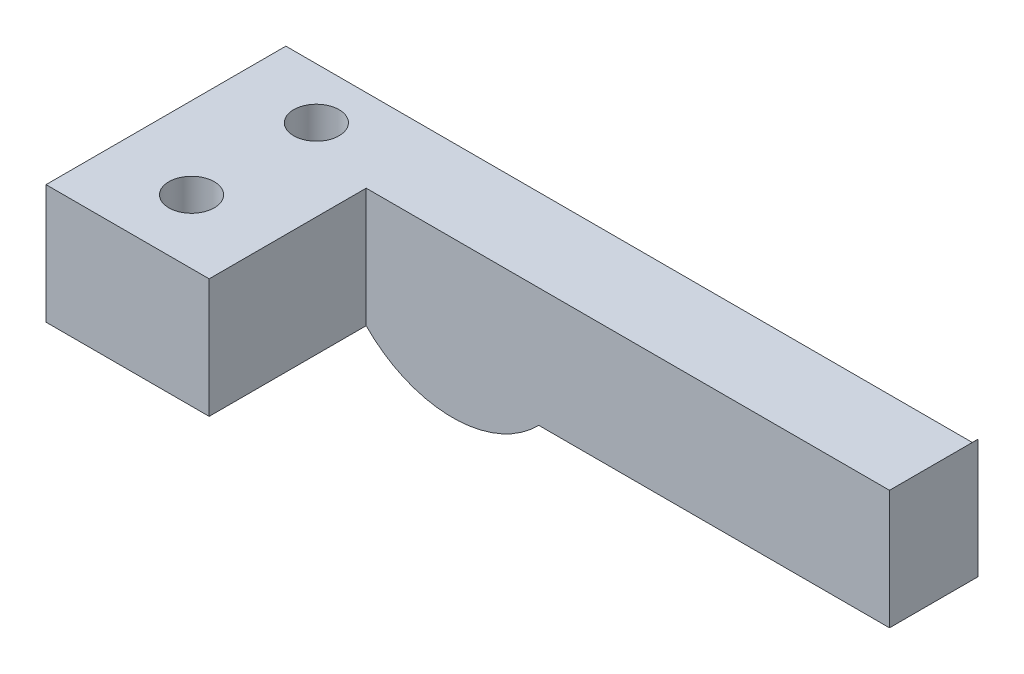
from build123d import *

# Parameters (mm, degrees)
BOSS_EXTRUDE3_DEPTH = 10.82
BOSS_EXTRUDE4_DEPTH = 3.9
SKETCH3_R           = 1
CUT_EXTRUDE1_DEPTH  = 5.25
CUT_EXTRUDE2_DEPTH  = 10


with BuildPart() as part:
    # Sketch2 → Boss-Extrude3 (new body)
    with BuildSketch(Plane.XY):
        Polygon((8.44, 0), (3, 0), (1.25, 0), (1.25, -5.25), (3, -5.25), (8.44, -5.25), align=None)
    extrude(amount=BOSS_EXTRUDE3_DEPTH)

    # Sketch2<5> → Boss-Extrude4 (add)
    with BuildSketch(Plane.XY):
        with BuildLine():
            Line((31.5, 0), (8.44, 0))
            Line((8.44, 0), (8.44, -5.25))
            ThreePointArc((8.44, -5.25), (12.24, -6.85540936), (16.04, -5.25))
            Line((16.04, -5.25), (31.5, -5.25))
            Line((31.5, -5.25), (31.5, 0))
        make_face()
    extrude(amount=BOSS_EXTRUDE4_DEPTH)

    # Sketch3 → Cut-Extrude1 (cut)
    with BuildSketch(Plane(origin=(0, 0, 0), x_dir=(1, 0, 0), z_dir=(0, 1, 0))):
        with Locations(Location((4.845, -2.5, 0), (0, 0, 270))):
            Circle(SKETCH3_R)
        with Locations(Location((4.845, -8, 0), (0, 0, 270))):
            Circle(SKETCH3_R)
    extrude(amount=-CUT_EXTRUDE1_DEPTH, mode=Mode.SUBTRACT)

    # Sketch4 → Cut-Extrude2 (cut)
    with BuildSketch(Plane(origin=(0, 0, 0), x_dir=(1, 0, 0), z_dir=(0, 1, 0))):
        Polygon((1.25, 0), (1.25, -0.249924402), (31.493852375, -0.249924402), (31.5, 0), align=None)
    extrude(amount=-CUT_EXTRUDE2_DEPTH, mode=Mode.SUBTRACT)


solid = part.part
